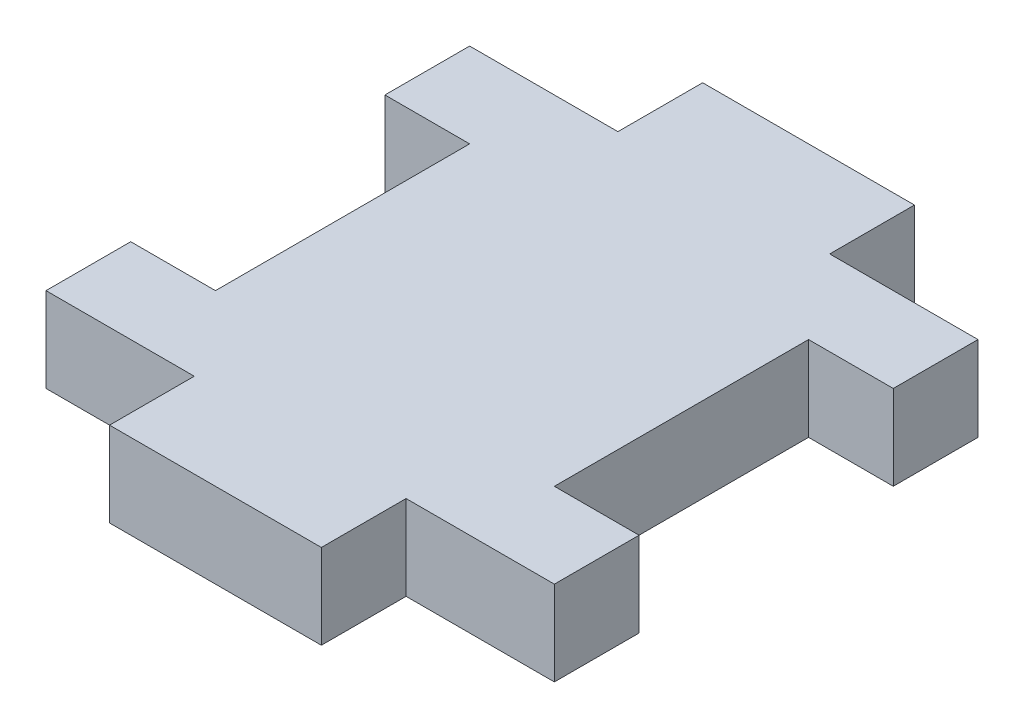
from build123d import *

# Parameters (mm, degrees)
BOSS_EXTRUDE2_DEPTH = 12.7


with BuildPart() as part:
    # Sketch1 → Boss-Extrude2 (new body)
    with BuildSketch(Plane(origin=(0, 0, 0), x_dir=(1, 0, 0), z_dir=(0, 1, 0))):
        Polygon((-15.875, -31.75), (-38.1, -31.75), (-38.1, -19.05), (-25.4, -19.05), (-25.4, 19.05), (-38.1, 19.05), (-38.1, 31.75), (-15.875, 31.75), (-15.875, 44.45), (15.875, 44.45), (15.875, 31.75), (38.1, 31.75), (38.1, 19.05), (25.4, 19.05), (25.4, -19.05), (38.1, -19.05), (38.1, -31.75), (15.875, -31.75), (15.875, -44.45), (-15.875, -44.45), align=None)
    extrude(amount=BOSS_EXTRUDE2_DEPTH)


solid = part.part
